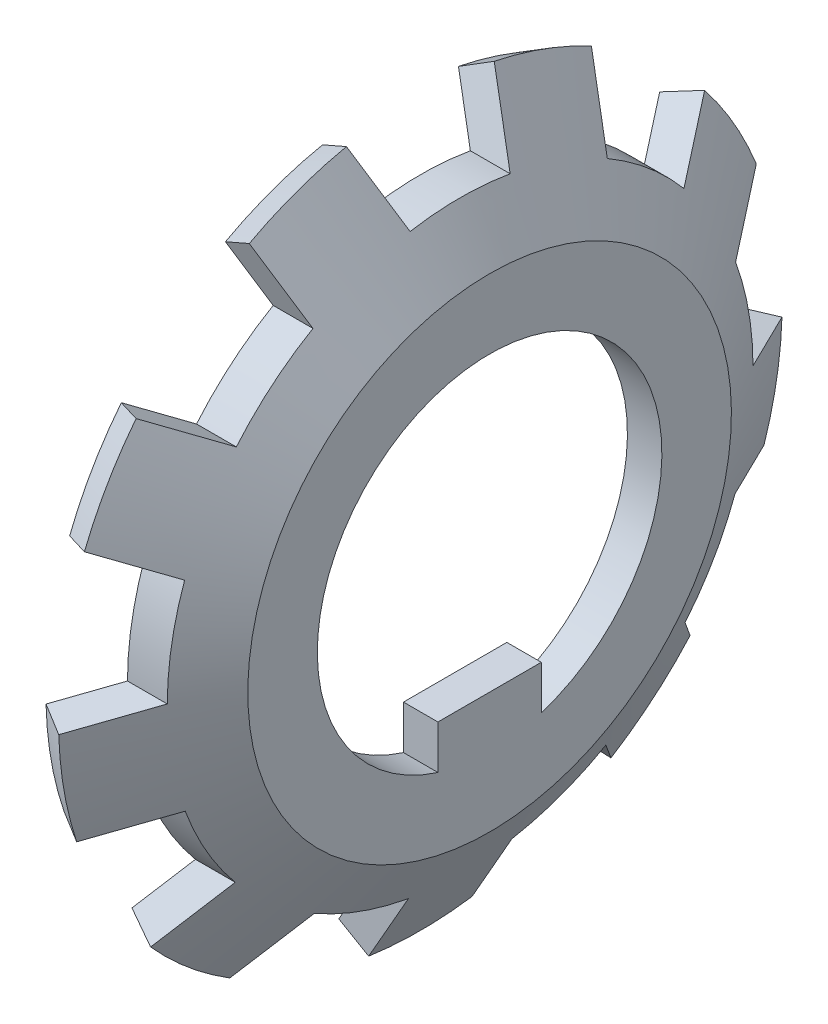
from build123d import *

# Parameters (mm, degrees)
ODEBRAT_VYSUNUT_M1_REACH = 17.125
ODEBRAT_VYSUNUT_M2_REACH = 17.125
KRUHOV_POLE1_COUNT       = 9


with BuildPart() as part:
    # Skica1 → Otočit kolem osy1 (revolve)
    with BuildSketch(Plane.XY):
        Polygon((0, 0), (0, 6.75), (-1.876388375, 10), (-1.010362971, 10.5), (1, 7.017949192), (1, 0), align=None)
    revolve(axis=Axis((0, 0, 0), (-1, 0, 0)))

    # Skica2 → Odebrat vysunutím1 (cut, up to next)
    with BuildSketch(Plane(origin=(1, 0, 0), x_dir=(0, 0, -1), z_dir=(1, 0, 0)), mode=Mode.PRIVATE) as odebrat_vysunut_m1_sk1:
        with BuildLine():
            Line((1.5, -4.769696007), (1.5, -3.5))
            Line((1.5, -3.5), (-1.5, -3.5))
            Line((-1.5, -3.5), (-1.5, -4.769696007))
            ThreePointArc((-1.5, -4.769696007), (0, 5), (1.5, -4.769696007))
        make_face()
    odebrat_vysunut_m1_tool1 = extrude(odebrat_vysunut_m1_sk1.sketch, amount=-ODEBRAT_VYSUNUT_M1_REACH, mode=Mode.PRIVATE) & part.part
    add(odebrat_vysunut_m1_tool1.solids().sort_by_distance((1, 0.242366, 0))[0], mode=Mode.SUBTRACT)

    # Skica3 → Odebrat vysunutím2 (cut, up to next)
    with BuildSketch(Plane(origin=(1, 0, 0), x_dir=(0, 0, -1), z_dir=(1, 0, 0)), mode=Mode.PRIVATE) as odebrat_vysunut_m2_sk1:
        with BuildLine():
            Line((-1.5, -10.392304845), (-1.5, -8.366600265))
            ThreePointArc((-1.5, -8.366600265), (-2.907171218, -7.987387277), (-4.228880321, -7.373369056))
            Line((-4.228880321, -7.373369056), (-5.530978126, -8.925148793))
            ThreePointArc((-5.530978126, -8.925148793), (-3.591211505, -9.866772518), (-1.5, -10.392304845))
        make_face()
    odebrat_vysunut_m2_tool1 = extrude(odebrat_vysunut_m2_sk1.sketch, amount=-ODEBRAT_VYSUNUT_M2_REACH, mode=Mode.PRIVATE) & part.part
    odebrat_vysunut_m2 = odebrat_vysunut_m2_tool1.solids().sort_by_distance((1, -8.932717, 3.251243))[0]
    add(odebrat_vysunut_m2, mode=Mode.SUBTRACT)

    # Kruhové pole1: Odebrat vysunutím2 ×9 about axis
    kruhov_pole1_axis = Axis((0, 0, 0), (1, 0, 0))
    for i in range(1, KRUHOV_POLE1_COUNT):
        add(odebrat_vysunut_m2.rotate(kruhov_pole1_axis, i * 360 / KRUHOV_POLE1_COUNT), mode=Mode.SUBTRACT)


solid = part.part
